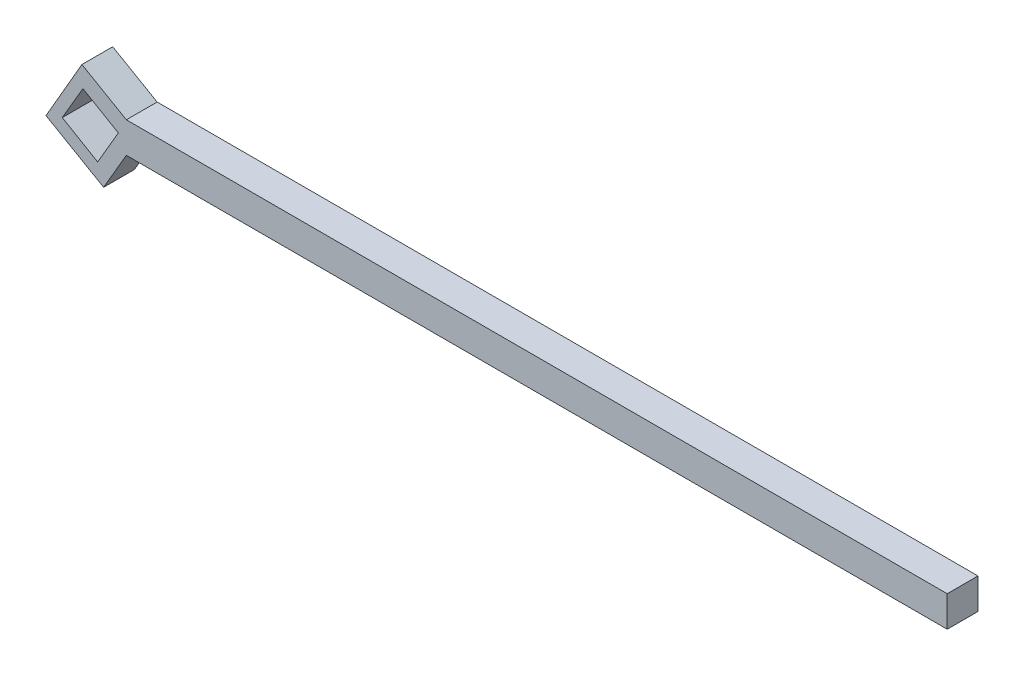
from build123d import *

# Parameters (mm, degrees)
EXTRUDE_2_DEPTH = 15


with BuildPart() as part:
    # 草图2 → 凸台-拉伸2 (new body)
    with BuildSketch(Plane.XY):
        Polygon((-359.835728953, 15), (40.164271047, 15), (40.164271047, 0), (-359.835728953, 0), (-370.899758445, -19.026698438), (-398.986364047, -2.810889132), (-381.486364047, 27.5), align=None)
        Polygon((-373.799917415, -9.77331612), (-391.073233535, 0.307980932), (-380.991936484, 17.581297051), (-363.718620364, 7.5), align=None, mode=Mode.SUBTRACT)
    extrude(amount=EXTRUDE_2_DEPTH)


solid = part.part
